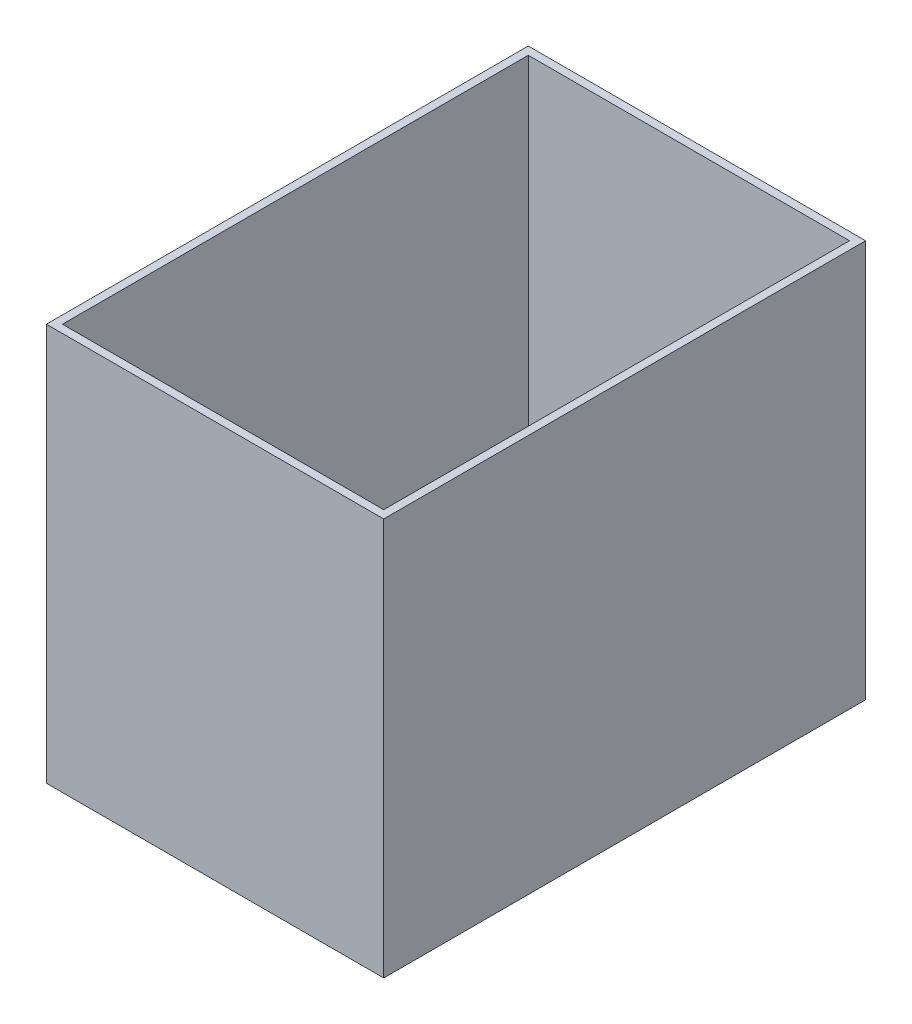
from build123d import *

# Parameters (mm, degrees)
SKETCH_1_W      = 210
SKETCH_1_H      = 300
SKETCH_1_W_2    = 200
SKETCH_1_H_2    = 290
EXTRUDE_1_DEPTH = 247.5


with BuildPart() as part:
    # 草图1 → 凸台-拉伸1 (new body)
    with BuildSketch(Plane(origin=(0, 0, 0), x_dir=(1, 0, 0), z_dir=(0, 1, 0))):
        Rectangle(SKETCH_1_W, SKETCH_1_H)
        Rectangle(SKETCH_1_W_2, SKETCH_1_H_2, mode=Mode.SUBTRACT)
    extrude(amount=EXTRUDE_1_DEPTH)


solid = part.part
